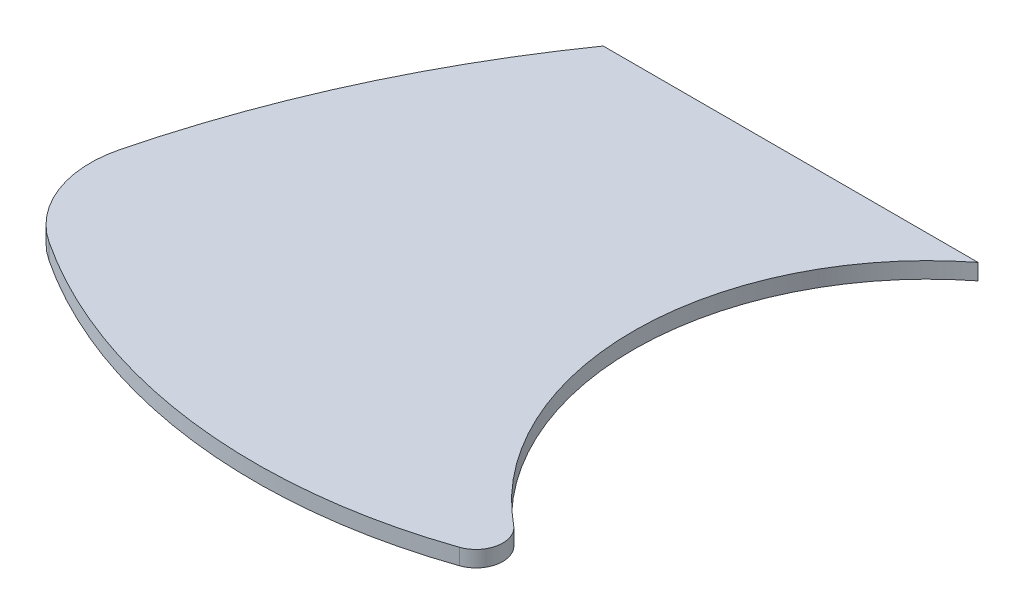
from build123d import *

# Parameters (mm, degrees)
BOSS_EXTRUDE1_DEPTH = 3


with BuildPart() as part:
    # Sketch2 → Boss-Extrude1 (new body)
    with BuildSketch(Plane(origin=(0, 0, 0), x_dir=(-1, 0, 0), z_dir=(0, 1, 0))):
        with BuildLine():
            Line((0, 0), (70, 0))
            ThreePointArc((70, 0), (87.015622115, 29.654658201), (98.389955297, 61.896784273))
            ThreePointArc((98.389955297, 61.896784273), (97.649210784, 74.044604409), (90.003901507, 83.513895964))
            ThreePointArc((90.003901507, 83.513895964), (47.456729901, 99.2211161), (2.347235642, 94.518765226))
            ThreePointArc((2.347235642, 94.518765226), (-0.943195566, 90.666547418), (0.820695537, 85.917315086))
            ThreePointArc((0.820695537, 85.917315086), (21.067224953, 42.761339844), (0, 0))
        make_face()
    extrude(amount=BOSS_EXTRUDE1_DEPTH)


solid = part.part
